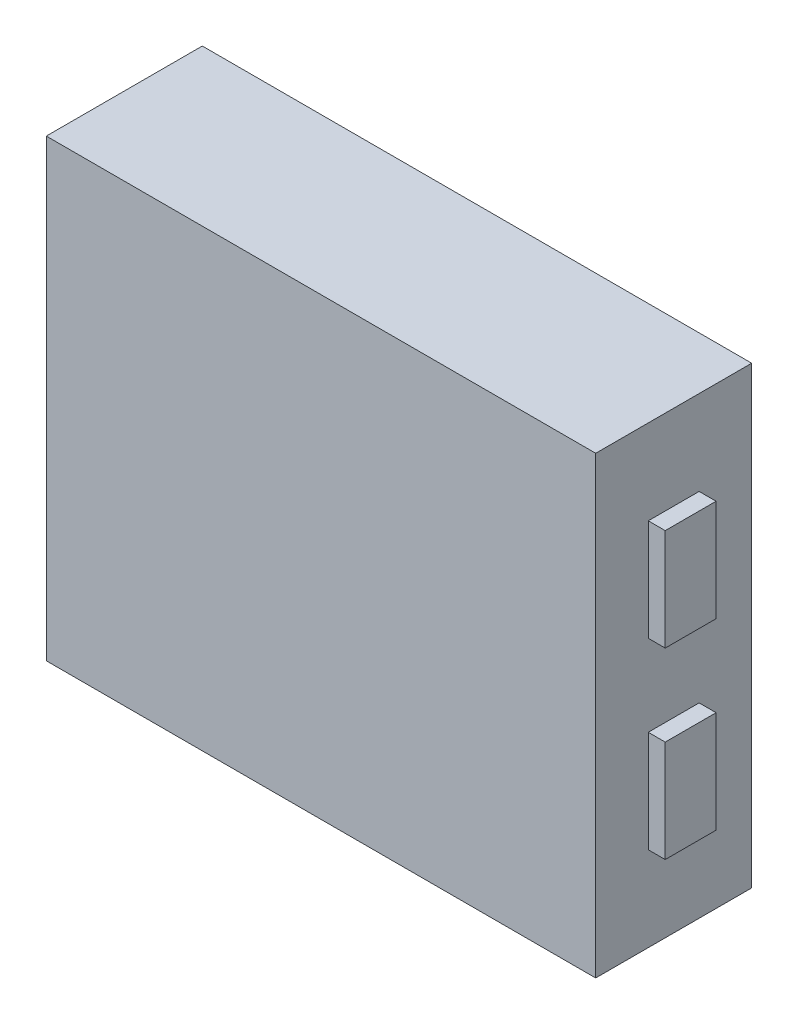
from build123d import *

# Parameters (mm, degrees)
ESQUISSE1_W        = 162
ESQUISSE1_H        = 134
BOSS_EXTRU_1_DEPTH = 46
ESQUISSE2_W        = 15
ESQUISSE2_H        = 30
BOSS_EXTRU_2_DEPTH = 5


with BuildPart() as part:
    # Esquisse1 → Boss.-Extru.1 (new body)
    with BuildSketch(Plane.XY):
        with Locations((32.209731544, -35.877516779)):
            Rectangle(ESQUISSE1_W, ESQUISSE1_H)
    extrude(amount=BOSS_EXTRU_1_DEPTH)

    # Esquisse2 → Boss.-Extru.2 (add)
    with BuildSketch(Plane(origin=(113.209731544, 0, 0), x_dir=(0, 0, -1), z_dir=(1, 0, 0))):
        with Locations((-23, -8.877516779)):
            Rectangle(ESQUISSE2_W, ESQUISSE2_H)
        with Locations((-23, -62.877516779)):
            Rectangle(ESQUISSE2_W, ESQUISSE2_H)
    extrude(amount=BOSS_EXTRU_2_DEPTH)


solid = part.part
